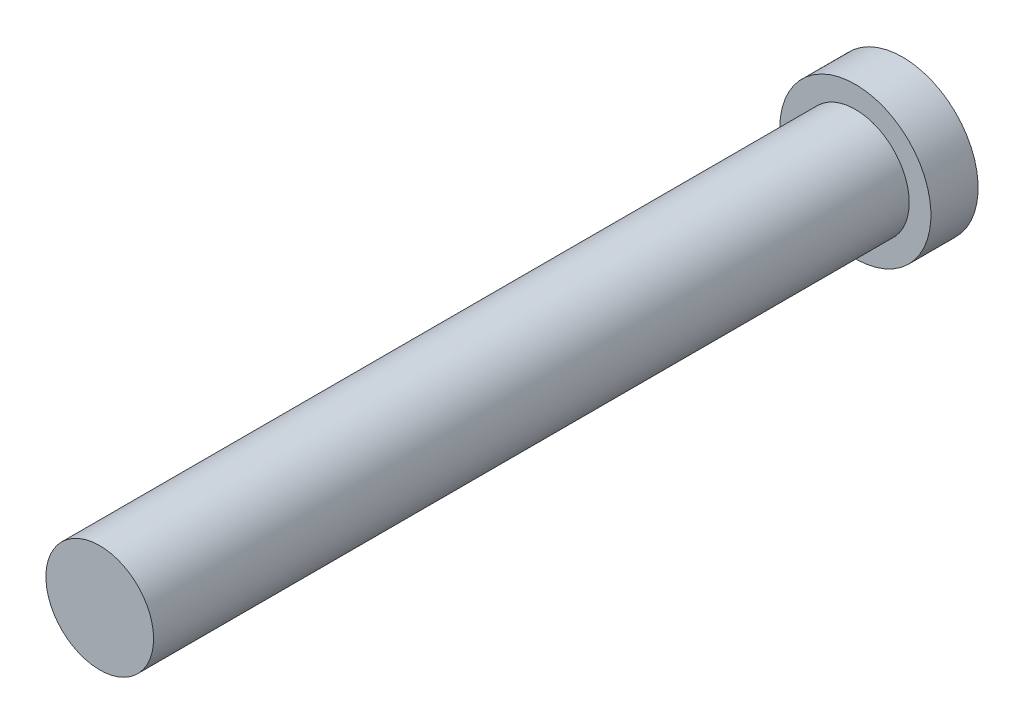
from build123d import *

# Parameters (mm, degrees)
SKETCH1_R               = 2.85
BOSS_EXTRUDE1_DEPTH     = 40
SKETCH2_R               = 4
BOSS_EXTRUDE2_DEPTH     = 5
CUT_EXTRUDE1_DEPTH      = 10
CUT_EXTRUDE1_DEPTH_BACK = 10
SKETCH3_W               = 2.5
SKETCH3_H               = 8


with BuildPart() as part:
    # Sketch1 → Boss-Extrude1 (new body)
    with BuildSketch(Plane.XY):
        Circle(SKETCH1_R)
    extrude(amount=BOSS_EXTRUDE1_DEPTH)

    # Sketch2 → Boss-Extrude2 (add)
    with BuildSketch(Plane(origin=(0, 0, 0), x_dir=(-1, 0, 0), z_dir=(0, 0, -1))):
        Circle(SKETCH2_R)
    extrude(amount=BOSS_EXTRUDE2_DEPTH)

    # Sketch3 → Cut-Extrude1 (cut, two sides: drawn at the far end of the back side and taken through both)
    with BuildSketch(Plane(origin=(0, 0, 0), x_dir=(0, 0, -1), z_dir=(1, 0, 0)).offset(-CUT_EXTRUDE1_DEPTH_BACK)):
        with Locations((3.75, 0)):
            Rectangle(SKETCH3_W, SKETCH3_H)
    extrude(amount=CUT_EXTRUDE1_DEPTH + CUT_EXTRUDE1_DEPTH_BACK, mode=Mode.SUBTRACT)


solid = part.part
